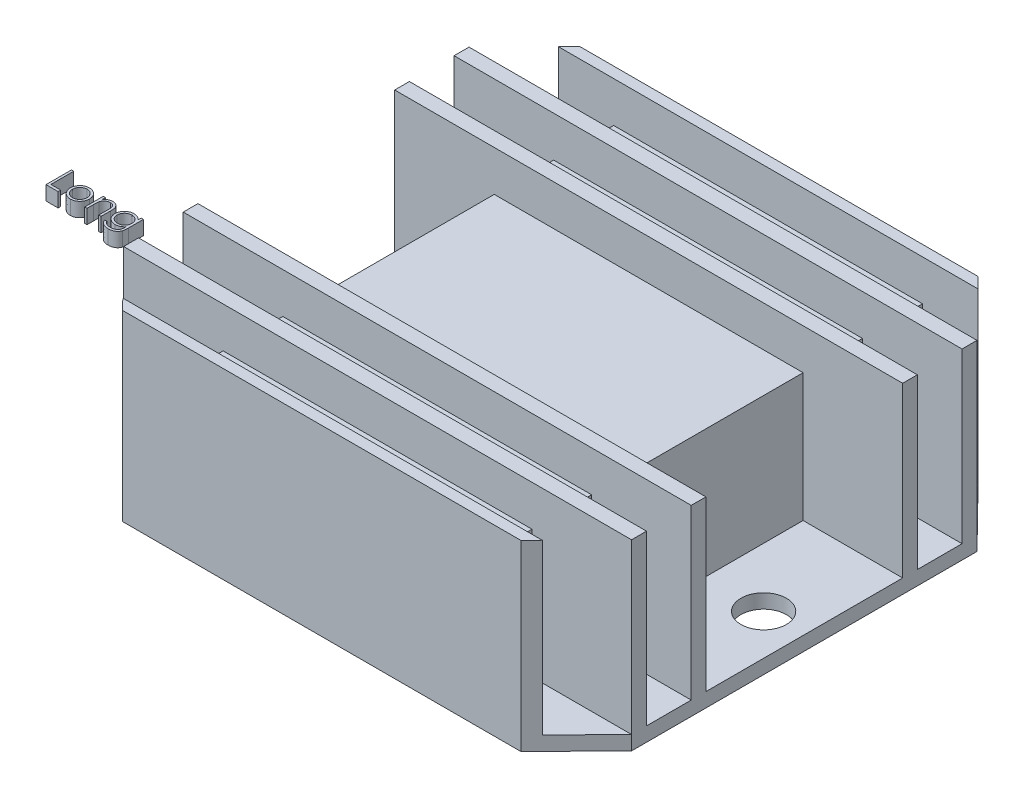
from build123d import *

# Parameters (mm, degrees)
BOSS_EXTRUDE1_DEPTH   = 1.778
BOSS_EXTRUDE1_2_DEPTH = 1.778
BOSS_EXTRUDE1_3_DEPTH = 1.778
BOSS_EXTRUDE1_4_DEPTH = 1.778
BOSS_EXTRUDE1_5_DEPTH = 1.778
SKETCH2_W             = 63.5
SKETCH2_H             = 1.867309241
SKETCH2_H_2           = 1.83559317
BOSS_EXTRUDE2_DEPTH   = 21.082
SKETCH3_W             = 38.608
SKETCH3_H             = 57.15
BOSS_EXTRUDE3_DEPTH   = 17.78
SKETCH4_R             = 2.842759409
CUT_EXTRUDE1_DEPTH    = 75.056497765


with BuildPart() as part:
    # Sketch1 → Boss-Extrude1 (new body)
    with BuildSketch(Plane(origin=(0, 0, 0), x_dir=(1, 0, 0), z_dir=(0, 1, 0))):
        Polygon((-24.892, -28.575), (24.892, -28.575), (31.75, -21.59), (31.75, 21.59), (24.892, 28.575), (-24.892, 28.575), (-31.75, 21.59), (-31.75, -21.59), align=None)
    extrude(amount=BOSS_EXTRUDE1_DEPTH)

    # Sketch2 → Boss-Extrude2 (add)
    with BuildSketch(Plane(origin=(0, 1.778, 0), x_dir=(1, 0, 0), z_dir=(0, 1, 0))):
        Polygon((-24.892, 28.575), (-26.219324492, 27.223095425), (26.219324492, 27.223095425), (24.892, 28.575), align=None)
        Polygon((26.219324492, -27.223095425), (24.892, -28.575), (-24.892, -28.575), (-26.219324492, -27.223095425), align=None)
        with Locations((0, 20.65634538)):
            Rectangle(SKETCH2_W, SKETCH2_H)
        with Locations((0, -20.65634538)):
            Rectangle(SKETCH2_W, SKETCH2_H)
        with Locations((0, 13.216894221)):
            Rectangle(SKETCH2_W, SKETCH2_H_2)
        with Locations((0, -13.216894221)):
            Rectangle(SKETCH2_W, SKETCH2_H_2)
    extrude(amount=BOSS_EXTRUDE2_DEPTH)

    # Sketch3 → Boss-Extrude3 (add)
    with BuildSketch(Plane(origin=(0, 0, 0), x_dir=(1, 0, 0), z_dir=(0, 1, 0))):
        Rectangle(SKETCH3_W, SKETCH3_H)
    extrude(amount=BOSS_EXTRUDE3_DEPTH)

    # Sketch4 → Cut-Extrude1 (cut, through all)
    with BuildSketch(Plane.XZ):
        with Locations(Location((-26.67, 0, 0), (0, 0, 270))):
            Circle(SKETCH4_R)
        with Locations(Location((26.67, 0, 0), (0, 0, 270))):
            Circle(SKETCH4_R)
    extrude(amount=-CUT_EXTRUDE1_DEPTH, mode=Mode.SUBTRACT)


with BuildPart() as body_2:
    # Sketch1 → Boss-Extrude1 2 (new body)
    with BuildSketch(Plane(origin=(0, 0, 0), x_dir=(1, 0, 0), z_dir=(0, 1, 0))):
        Polygon((-64.383651933, 4.516913908), (-64.098716035, 4.516913908), (-64.098716035, 1.667554934), (-62.877562189, 1.667554934), (-62.877562189, 1.341913908), (-64.383651933, 1.341913908), align=None)
    extrude(amount=BOSS_EXTRUDE1_2_DEPTH)


with BuildPart() as body_3:
    # Sketch1 → Boss-Extrude1 3 (new body)
    with BuildSketch(Plane(origin=(0, 0, 0), x_dir=(1, 0, 0), z_dir=(0, 1, 0))):
        with BuildLine():
            add(Edge.make_bspline(
                [(-61.309142718, 3.702811344), (-61.265607778, 3.701884343), (-61.180246399, 3.70006672), (-61.05523496, 3.680640286), (-60.935904729, 3.650933749), (-60.821798683, 3.609865975), (-60.714378187, 3.554818777), (-60.612078558, 3.489133205), (-60.515180272, 3.411316138), (-60.457102238, 3.351119891), (-60.427622285, 3.320564749)],
                knots=[0, 0, 0, 0, 1.054011418, 2.066658804, 3.057071809, 4.030435133, 4.997543892, 5.974964718, 6.972108034, 8, 8, 8, 8], degree=3))
            add(Edge.make_bspline(
                [(-60.427622285, 3.320564749), (-60.402238656, 3.291342062), (-60.351962639, 3.233462227), (-60.28749588, 3.139613207), (-60.231959179, 3.04242183), (-60.187452064, 2.940597469), (-60.152359221, 2.835029018), (-60.127443911, 2.725353622), (-60.112623977, 2.611813493), (-60.110625572, 2.534702868), (-60.109613471, 2.495649885)],
                knots=[0, 0, 0, 0, 1.025258237, 2.030674902, 3.01204498, 3.988269485, 4.97094183, 5.956517959, 6.965070386, 8, 8, 8, 8], degree=3))
            add(Edge.make_bspline(
                [(-60.109613471, 2.495649885), (-60.110503684, 2.456370547), (-60.112262787, 2.378752744), (-60.128903068, 2.264435176), (-60.154784838, 2.153587015), (-60.191825149, 2.046672343), (-60.239321434, 1.94336435), (-60.297279414, 1.844114259), (-60.36610581, 1.748726252), (-60.444123721, 1.658010299), (-60.530349352, 1.574402375), (-60.623890429, 1.501533159), (-60.722908731, 1.439102205), (-60.828720916, 1.388813457), (-60.940360708, 1.349162514), (-61.058068905, 1.321313214), (-61.181662647, 1.304475115), (-61.266051627, 1.302312873), (-61.309142718, 1.30120878)],
                knots=[0, 0, 0, 0, 0.998656419, 1.973391657, 2.932242238, 3.890759089, 4.846373663, 5.82037756, 6.809684879, 7.83454468, 8.860553229, 9.859544525, 10.845671541, 11.83227036, 12.833544569, 13.85385346, 14.904124723, 16, 16, 16, 16], degree=3))
            add(Edge.make_bspline(
                [(-61.309142718, 1.30120878), (-61.352444928, 1.302316579), (-61.437254493, 1.30448626), (-61.561284491, 1.321247795), (-61.679203646, 1.349149679), (-61.790989589, 1.388943762), (-61.8972567, 1.439103813), (-61.996848736, 1.501344417), (-62.090465802, 1.574423986), (-62.176709674, 1.658004443), (-62.254722695, 1.748727761), (-62.323550352, 1.844113867), (-62.381508005, 1.943364452), (-62.429004376, 2.046672316), (-62.466044663, 2.153587023), (-62.49192644, 2.264435174), (-62.508566719, 2.378752744), (-62.510325822, 2.456370548), (-62.511216035, 2.495649885)],
                knots=[0, 0, 0, 0, 1.099876186, 2.154163076, 3.173186993, 4.173200201, 5.163417411, 6.152872554, 7.150605724, 8.17532212, 9.198891216, 10.186952605, 11.159729845, 12.11414092, 13.071450619, 14.029093627, 15.002601286, 16, 16, 16, 16], degree=3))
            add(Edge.make_bspline(
                [(-62.511216035, 2.495649885), (-62.510197032, 2.534490609), (-62.508179582, 2.611388567), (-62.493374548, 2.724715258), (-62.468556429, 2.834205032), (-62.43342152, 2.939366), (-62.388504168, 3.040744145), (-62.333747857, 3.138175671), (-62.268623497, 3.231600318), (-62.218547441, 3.289405348), (-62.193207221, 3.318656696)],
                knots=[0, 0, 0, 0, 1.031353054, 2.041901799, 3.029428768, 4.008703097, 4.981709435, 5.96992636, 6.972712378, 8, 8, 8, 8], degree=3))
            add(Edge.make_bspline(
                [(-62.193207221, 3.318656696), (-62.163771714, 3.34947682), (-62.105881609, 3.410090016), (-62.008500977, 3.487680234), (-61.906453011, 3.554732672), (-61.797845399, 3.608686096), (-61.683833092, 3.651175323), (-61.563891351, 3.680716898), (-61.438455705, 3.699996727), (-61.35267662, 3.701863788), (-61.309142718, 3.702811344)],
                knots=[0, 0, 0, 0, 1.027980169, 2.021703884, 2.998553061, 3.971491411, 4.943284454, 5.930300938, 6.949603206, 8, 8, 8, 8], degree=3))
        make_face()
        with BuildLine():
            add(Edge.make_bspline(
                [(-61.310414753, 3.417875446), (-61.341201015, 3.417000424), (-61.401978796, 3.415272968), (-61.491440848, 3.402133997), (-61.57756513, 3.381317332), (-61.660515039, 3.351740796), (-61.740010845, 3.31355108), (-61.81612866, 3.266644211), (-61.889092374, 3.211641457), (-61.957474674, 3.148628891), (-62.020232914, 3.079795803), (-62.075095079, 3.006454792), (-62.121744997, 2.929795463), (-62.160607141, 2.8497381), (-62.189551519, 2.765471411), (-62.21057276, 2.677949695), (-62.223699336, 2.586994639), (-62.225410551, 2.525162858), (-62.226280138, 2.493741833)],
                knots=[0, 0, 0, 0, 1.021534396, 2.016698045, 2.994645724, 3.958388632, 4.93408049, 5.916473867, 6.921342795, 7.962252576, 8.998418191, 10.008913653, 10.997312074, 11.973003931, 12.956656626, 13.948281152, 14.957379055, 16, 16, 16, 16], degree=3))
            add(Edge.make_bspline(
                [(-62.226280138, 2.493741833), (-62.224822519, 2.453145351), (-62.221929419, 2.372568926), (-62.198402454, 2.25390455), (-62.159044901, 2.13998387), (-62.105897868, 2.03147472), (-62.039307941, 1.931079153), (-61.960851817, 1.841570021), (-61.871371517, 1.764294321), (-61.771933692, 1.700176697), (-61.664569418, 1.649231775), (-61.550944041, 1.613128419), (-61.432434268, 1.589659098), (-61.351443891, 1.587326403), (-61.310414753, 1.586144677)],
                knots=[0, 0, 0, 0, 1.016792936, 2.018143844, 3.017858371, 4.030088057, 5.03801393, 6.028138512, 7.003788237, 7.991172063, 8.984598303, 9.972568034, 10.972917682, 12, 12, 12, 12], degree=3))
            add(Edge.make_bspline(
                [(-61.310414753, 1.586144677), (-61.269387976, 1.587333288), (-61.188402256, 1.589679574), (-61.070057146, 1.613010218), (-60.956742329, 1.649389967), (-60.84948957, 1.700119401), (-60.750097008, 1.764537805), (-60.659973163, 1.841133662), (-60.582186922, 1.931316227), (-60.515662867, 2.031607699), (-60.461645464, 2.139815647), (-60.422472131, 2.253925576), (-60.398888607, 2.372563571), (-60.396003141, 2.453143557), (-60.394549369, 2.493741833)],
                knots=[0, 0, 0, 0, 1.02726834, 2.027799167, 3.010890988, 4.004497153, 4.992059811, 5.971914811, 6.958719428, 7.966827853, 8.981595046, 9.981490638, 10.983022906, 12, 12, 12, 12], degree=3))
            add(Edge.make_bspline(
                [(-60.394549369, 2.493741833), (-60.395418656, 2.525163046), (-60.397129282, 2.586995196), (-60.410260143, 2.677947565), (-60.431265525, 2.765479227), (-60.460268349, 2.849709259), (-60.498961633, 2.930002745), (-60.546511153, 3.006229712), (-60.601149297, 3.080049864), (-60.664664828, 3.148406381), (-60.73297575, 3.211666021), (-60.805969034, 3.266665539), (-60.881973979, 3.313344929), (-60.961238836, 3.352067447), (-61.04419938, 3.381048249), (-61.13020299, 3.402254193), (-61.219283339, 3.415217443), (-61.279843328, 3.416983779), (-61.310414753, 3.417875446)],
                knots=[0, 0, 0, 0, 1.042956736, 2.052379634, 3.044323526, 4.02829302, 5.004299113, 5.996692471, 7.007513377, 8.048758398, 9.090003419, 10.095195979, 11.07790575, 12.047570684, 13.018257071, 13.989683339, 14.985167495, 16, 16, 16, 16], degree=3))
        make_face(mode=Mode.SUBTRACT)
    extrude(amount=BOSS_EXTRUDE1_3_DEPTH)


with BuildPart() as body_4:
    # Sketch1 → Boss-Extrude1 4 (new body)
    with BuildSketch(Plane(origin=(0, 0, 0), x_dir=(1, 0, 0), z_dir=(0, 1, 0))):
        with BuildLine():
            Line((-59.539741676, 3.662106216), (-59.254805779, 3.662106216))
            Line((-59.254805779, 3.662106216), (-59.254805779, 3.243606616))
            add(Edge.make_bspline(
                [(-59.254805779, 3.243606616), (-59.224382353, 3.281563943), (-59.165344633, 3.355221461), (-59.067024559, 3.452032268), (-58.963116878, 3.531811151), (-58.854257918, 3.595405307), (-58.740299901, 3.643344746), (-58.621937471, 3.677966698), (-58.498461987, 3.698726506), (-58.41449282, 3.701439073), (-58.372013311, 3.702811344)],
                knots=[0, 0, 0, 0, 1.12780773, 2.188550248, 3.19190651, 4.159438251, 5.104880172, 6.052711206, 7.014878035, 8, 8, 8, 8], degree=3))
            add(Edge.make_bspline(
                [(-58.372013311, 3.702811344), (-58.329077664, 3.701228202), (-58.245042247, 3.698129612), (-58.122688577, 3.673621614), (-58.008412713, 3.631761275), (-57.902622116, 3.574418897), (-57.807256715, 3.503111596), (-57.723504886, 3.420037466), (-57.654232511, 3.32448259), (-57.607789189, 3.235833727), (-57.577195209, 3.157194606), (-57.557934445, 3.089842197), (-57.541577769, 3.014805017), (-57.527397541, 2.932309819), (-57.517802589, 2.841778603), (-57.510234939, 2.743582483), (-57.504811409, 2.637753264), (-57.504596229, 2.564558967), (-57.504485266, 2.526814749)],
                knots=[0, 0, 0, 0, 1.235846778, 2.418850247, 3.575807741, 4.728682307, 5.871620074, 6.994088408, 8.11269785, 9.256955736, 9.865816715, 10.540099792, 11.271859618, 12.076849838, 12.949306005, 13.892391288, 14.913166135, 16, 16, 16, 16], degree=3))
            Line((-57.504485266, 2.526814749), (-57.504485266, 1.341913908))
            Line((-57.504485266, 1.341913908), (-57.789421163, 1.341913908))
            Line((-57.789421163, 1.341913908), (-57.789421163, 2.433320158))
            add(Edge.make_bspline(
                [(-57.789421163, 2.433320158), (-57.789596431, 2.46490909), (-57.789931687, 2.525333341), (-57.790989095, 2.611846669), (-57.793537991, 2.690302351), (-57.797119675, 2.76051282), (-57.802362081, 2.822410658), (-57.807825468, 2.87612193), (-57.814506554, 2.921578444), (-57.820460054, 2.948942483), (-57.823130098, 2.961214789)],
                knots=[0, 0, 0, 0, 1.430800155, 2.736877192, 3.918605307, 4.986035426, 5.920637409, 6.731861385, 7.431261377, 8, 8, 8, 8], degree=3))
            add(Edge.make_bspline(
                [(-57.823130098, 2.961214789), (-57.832768973, 2.997238507), (-57.851320825, 3.066573018), (-57.897162367, 3.160620467), (-57.955050945, 3.240628823), (-58.025715423, 3.30610342), (-58.108473227, 3.357058394), (-58.203094707, 3.392413338), (-58.308666759, 3.414526097), (-58.382920378, 3.416727852), (-58.421622686, 3.417875446)],
                knots=[0, 0, 0, 0, 1.084156227, 2.086665306, 3.027808233, 3.945421172, 4.874247719, 5.839848303, 6.874090471, 8, 8, 8, 8], degree=3))
            add(Edge.make_bspline(
                [(-58.421622686, 3.417875446), (-58.444544085, 3.417443642), (-58.48990494, 3.416589113), (-58.557169558, 3.408015435), (-58.622415058, 3.393992408), (-58.686296247, 3.375061572), (-58.74753546, 3.349060799), (-58.80810021, 3.319552014), (-58.865709918, 3.282768993), (-58.921592999, 3.241774643), (-58.973583903, 3.196345648), (-59.021960325, 3.148408128), (-59.0650841, 3.097358116), (-59.104153541, 3.044018164), (-59.137879537, 2.987655711), (-59.167319124, 2.928814518), (-59.192297933, 2.867417141), (-59.20471009, 2.824804049), (-59.210920563, 2.803482417)],
                knots=[0, 0, 0, 0, 1.023777757, 2.026029729, 3.023749952, 4.003683103, 4.997618607, 5.993177895, 7.010360494, 8.046726602, 9.087585522, 10.09234134, 11.086953743, 12.070360549, 13.043493632, 14.017870808, 15.008233677, 16, 16, 16, 16], degree=3))
            add(Edge.make_bspline(
                [(-59.210920563, 2.803482417), (-59.214494387, 2.787829483), (-59.222274415, 2.753753864), (-59.230677442, 2.69783357), (-59.238304314, 2.633145235), (-59.244687841, 2.559764348), (-59.248593469, 2.477433989), (-59.252851957, 2.386505765), (-59.25440232, 2.286617101), (-59.254667526, 2.217073994), (-59.254805779, 2.180821159)],
                knots=[0, 0, 0, 0, 0.615963638, 1.340920617, 2.168419149, 3.115676021, 4.16674242, 5.331190069, 6.6087489, 8, 8, 8, 8], degree=3))
            Line((-59.254805779, 2.180821159), (-59.254805779, 1.341913908))
            Line((-59.254805779, 1.341913908), (-59.539741676, 1.341913908))
            Line((-59.539741676, 1.341913908), (-59.539741676, 3.662106216))
        make_face()
    extrude(amount=BOSS_EXTRUDE1_4_DEPTH)


with BuildPart() as body_5:
    # Sketch1 → Boss-Extrude1 5 (new body)
    with BuildSketch(Plane(origin=(0, 0, 0), x_dir=(1, 0, 0), z_dir=(0, 1, 0))):
        with BuildLine():
            Line((-54.817946804, 3.662106216), (-54.533010907, 3.662106216))
            Line((-54.533010907, 3.662106216), (-54.533010907, 1.820835182))
            add(Edge.make_bspline(
                [(-54.533010907, 1.820835182), (-54.533262224, 1.781612507), (-54.533747327, 1.705903296), (-54.537240708, 1.596430856), (-54.544607322, 1.495315193), (-54.552960912, 1.402095144), (-54.564977576, 1.317202802), (-54.579651852, 1.240384852), (-54.596194218, 1.171567577), (-54.610726844, 1.129181471), (-54.617601252, 1.109131456)],
                knots=[0, 0, 0, 0, 1.307562039, 2.523909702, 3.650326591, 4.686913197, 5.643429486, 6.506965704, 7.293745905, 8, 8, 8, 8], degree=3))
            add(Edge.make_bspline(
                [(-54.617601252, 1.109131456), (-54.62775149, 1.083069313), (-54.64774848, 1.031724268), (-54.685200448, 0.958940277), (-54.727141203, 0.890408909), (-54.77504447, 0.826512078), (-54.828693628, 0.76757055), (-54.886824695, 0.71230378), (-54.950569798, 0.661880999), (-55.019892487, 0.617172194), (-55.09319474, 0.576906794), (-55.170434418, 0.542030266), (-55.251175973, 0.511652915), (-55.336177881, 0.488899236), (-55.424107451, 0.469182739), (-55.515998692, 0.456351488), (-55.611314729, 0.447618371), (-55.676125896, 0.446810803), (-55.709007502, 0.446401087)],
                knots=[0, 0, 0, 0, 0.981931301, 1.934503488, 2.87077864, 3.801706999, 4.735015492, 5.667491629, 6.616593066, 7.585388521, 8.561939025, 9.551802639, 10.560317337, 11.588439944, 12.640189604, 13.723962949, 14.845264515, 16, 16, 16, 16], degree=3))
            add(Edge.make_bspline(
                [(-55.709007502, 0.446401087), (-55.756981511, 0.447178042), (-55.85068764, 0.448695644), (-55.987307883, 0.466376689), (-56.117060808, 0.491372441), (-56.238231922, 0.529205222), (-56.35005551, 0.575503063), (-56.451767883, 0.628657056), (-56.542455959, 0.689607357), (-56.624211005, 0.759004331), (-56.697999448, 0.841521385), (-56.767420632, 0.938766051), (-56.834241629, 1.052219586), (-56.873401751, 1.13548869), (-56.893908343, 1.179093395)],
                knots=[0, 0, 0, 0, 1.157897085, 2.2616841, 3.32207898, 4.345638746, 5.321241055, 6.241986252, 7.112515963, 7.955008012, 8.825025602, 9.77857164, 10.836726669, 12, 12, 12, 12], degree=3))
            Line((-56.893908343, 1.179093395), (-56.608972446, 1.179093395))
            add(Edge.make_bspline(
                [(-56.608972446, 1.179093395), (-56.586056013, 1.142711636), (-56.541257209, 1.071589778), (-56.457483944, 0.979502844), (-56.365675348, 0.900805149), (-56.262733064, 0.837386089), (-56.148228761, 0.789570779), (-56.022093553, 0.755484617), (-55.883301039, 0.735077289), (-55.786673802, 0.732617758), (-55.73635626, 0.731336985)],
                knots=[0, 0, 0, 0, 0.997731894, 1.950442991, 2.880492273, 3.800895997, 4.748200782, 5.754801363, 6.83083817, 8, 8, 8, 8], degree=3))
            add(Edge.make_bspline(
                [(-55.73635626, 0.731336985), (-55.686674866, 0.732634334), (-55.590894113, 0.735135494), (-55.453161552, 0.755493724), (-55.327436144, 0.789578196), (-55.214442248, 0.837301518), (-55.115513086, 0.895767244), (-55.03023078, 0.961081597), (-54.961156681, 1.034724364), (-54.914699204, 1.102562146), (-54.885820658, 1.162999749), (-54.867430843, 1.215026747), (-54.8524866, 1.273857571), (-54.839986318, 1.339294989), (-54.829671275, 1.411432493), (-54.823137232, 1.490435023), (-54.818414817, 1.576123032), (-54.818106416, 1.635534664), (-54.817946804, 1.666282898)],
                knots=[0, 0, 0, 0, 1.570740765, 3.028230971, 4.391408896, 5.680370741, 6.894727393, 8.017376726, 9.065722033, 10.075533815, 10.603371122, 11.180248986, 11.817768598, 12.521299649, 13.286540596, 14.121245857, 15.027658897, 16, 16, 16, 16], degree=3))
            Line((-54.817946804, 1.666282898), (-54.817946804, 1.78649023))
            add(Edge.make_bspline(
                [(-54.817946804, 1.78649023), (-54.846867532, 1.752071595), (-54.904200282, 1.683839739), (-55.0032125, 1.594430254), (-55.111359273, 1.517426407), (-55.228456487, 1.45427236), (-55.351635821, 1.403761354), (-55.47956313, 1.368434525), (-55.611091637, 1.345610901), (-55.700220373, 1.343154979), (-55.745260506, 1.341913908)],
                knots=[0, 0, 0, 0, 1.012485704, 2.007162095, 2.997754123, 3.998611389, 4.999708251, 5.992315798, 6.98544096, 8, 8, 8, 8], degree=3))
            add(Edge.make_bspline(
                [(-55.745260506, 1.341913908), (-55.771781979, 1.34238111), (-55.824511071, 1.343309987), (-55.902847163, 1.351436878), (-55.980027275, 1.363228594), (-56.055871406, 1.380538185), (-56.130488998, 1.40275568), (-56.203756742, 1.430529436), (-56.27626787, 1.461930293), (-56.346704336, 1.49891705), (-56.414364612, 1.540067143), (-56.478738358, 1.584643137), (-56.53948839, 1.632411727), (-56.596036491, 1.683843951), (-56.648308486, 1.73886537), (-56.697007423, 1.79688945), (-56.741328017, 1.858726422), (-56.782179734, 1.923248734), (-56.817610512, 1.990886143), (-56.848711335, 2.060171987), (-56.875752724, 2.130958117), (-56.897311338, 2.203481524), (-56.913776991, 2.277696486), (-56.926032697, 2.353481422), (-56.932984071, 2.431069702), (-56.934068037, 2.483340497), (-56.934613471, 2.509642273)],
                knots=[0, 0, 0, 0, 1.028754217, 2.045334182, 3.052854819, 4.056607503, 5.061168794, 6.071104265, 7.095078842, 8.125279047, 9.155117945, 10.165957491, 11.161587969, 12.151493252, 13.128948131, 14.104219989, 15.088194871, 16.07871515, 17.064853787, 18.047899887, 19.02414258, 20.002704429, 20.980574569, 21.971845993, 22.979467364, 24, 24, 24, 24], degree=3))
            add(Edge.make_bspline(
                [(-56.934613471, 2.509642273), (-56.934142513, 2.535952225), (-56.933202421, 2.588470225), (-56.925082604, 2.666375096), (-56.913500032, 2.743236798), (-56.895168699, 2.818263084), (-56.873104697, 2.892308394), (-56.845778313, 2.964825808), (-56.812922724, 3.035837413), (-56.775721023, 3.105395795), (-56.733916167, 3.17256756), (-56.688075988, 3.236363875), (-56.638145145, 3.296315288), (-56.584812479, 3.353026613), (-56.527426788, 3.405950682), (-56.466017759, 3.454959043), (-56.401190717, 3.500873196), (-56.332744748, 3.542702766), (-56.261735974, 3.579698089), (-56.189968439, 3.613455231), (-56.116491469, 3.640246896), (-56.042674951, 3.663853565), (-55.967218885, 3.68057692), (-55.891048464, 3.693478526), (-55.813902915, 3.701338665), (-55.762238503, 3.702319817), (-55.73635626, 3.702811344)],
                knots=[0, 0, 0, 0, 1.008818848, 2.013730394, 3.001654427, 3.987803273, 4.973046549, 5.963777569, 6.957074694, 7.972068341, 8.987420212, 9.989399531, 10.982630087, 11.977756091, 12.973280677, 13.973972381, 14.989194003, 16.018387222, 17.047741039, 18.059210846, 19.057554164, 20.045176975, 21.029480261, 22.018708529, 23.007435371, 24, 24, 24, 24], degree=3))
            add(Edge.make_bspline(
                [(-55.73635626, 3.702811344), (-55.693674336, 3.701580647), (-55.609390653, 3.6991504), (-55.485356101, 3.680081218), (-55.36566564, 3.64967922), (-55.249643869, 3.606122184), (-55.136345671, 3.546658935), (-55.026144455, 3.468333546), (-54.918721383, 3.370443452), (-54.852429351, 3.295374783), (-54.817946804, 3.256326969)],
                knots=[0, 0, 0, 0, 0.96728863, 1.910097829, 2.838038873, 3.762875196, 4.71315279, 5.730631239, 6.819562287, 8, 8, 8, 8], degree=3))
            Line((-54.817946804, 3.256326969), (-54.817946804, 3.662106216))
        make_face()
        with BuildLine():
            add(Edge.make_bspline(
                [(-55.713459625, 3.417875446), (-55.755125335, 3.416459337), (-55.837614606, 3.413655741), (-55.958526174, 3.389721036), (-56.075254535, 3.352214399), (-56.18556803, 3.298563597), (-56.288898051, 3.233163824), (-56.380587353, 3.153933706), (-56.460783241, 3.063449656), (-56.528622049, 2.962529789), (-56.582625503, 2.85365244), (-56.620855605, 2.738889131), (-56.645575269, 2.620094244), (-56.648303639, 2.539020526), (-56.649677574, 2.498193956)],
                knots=[0, 0, 0, 0, 1.026226791, 2.031711442, 3.026614839, 4.04107745, 5.047145931, 6.032893242, 7.017642609, 8.019221815, 9.021877557, 10.003543541, 10.994637589, 12, 12, 12, 12], degree=3))
            add(Edge.make_bspline(
                [(-56.649677574, 2.498193956), (-56.649019209, 2.46741163), (-56.647724397, 2.406871797), (-56.635275151, 2.318028135), (-56.615153847, 2.233409565), (-56.58663581, 2.153010968), (-56.551300151, 2.07637119), (-56.506857072, 2.00401817), (-56.454559405, 1.935887472), (-56.394816484, 1.872483011), (-56.328979337, 1.814733418), (-56.257569778, 1.763989624), (-56.180684659, 1.722487184), (-56.100214909, 1.686617996), (-56.014208009, 1.660420556), (-55.923902767, 1.640428235), (-55.828660299, 1.628990291), (-55.763734507, 1.62757261), (-55.730632101, 1.626849805)],
                knots=[0, 0, 0, 0, 1.039728707, 2.044842319, 3.024901384, 3.974314358, 4.923051295, 5.871625912, 6.837440708, 7.820715446, 8.810779094, 9.792721783, 10.773906224, 11.758876063, 12.764959493, 13.806266761, 14.881525401, 16, 16, 16, 16], degree=3))
            add(Edge.make_bspline(
                [(-55.730632101, 1.626849805), (-55.697100692, 1.627546136), (-55.631530376, 1.628907804), (-55.535762455, 1.640613121), (-55.44501847, 1.659501628), (-55.359381624, 1.686319515), (-55.278528578, 1.720538532), (-55.203367607, 1.763842463), (-55.132287114, 1.81315877), (-55.067556657, 1.870682525), (-55.009024021, 1.934078199), (-54.958014683, 2.003061783), (-54.914549433, 2.076595254), (-54.878556118, 2.154670323), (-54.851077668, 2.237893743), (-54.832645519, 2.326057466), (-54.819757971, 2.418739108), (-54.818559704, 2.482246924), (-54.817946804, 2.514730414)],
                knots=[0, 0, 0, 0, 1.121943988, 2.193949579, 3.223793937, 4.220241907, 5.192961521, 6.155822191, 7.11847367, 8.083710714, 9.04790392, 10.001595906, 10.949595423, 11.902125208, 12.873731292, 13.87582262, 14.913508608, 16, 16, 16, 16], degree=3))
            add(Edge.make_bspline(
                [(-54.817946804, 2.514730414), (-54.819161984, 2.557019468), (-54.821536018, 2.639637417), (-54.843939868, 2.760021414), (-54.880062488, 2.873204425), (-54.93072347, 2.978828489), (-54.994207149, 3.075774437), (-55.070670991, 3.162246782), (-55.158796319, 3.238356845), (-55.258329938, 3.301764492), (-55.365415835, 3.352986707), (-55.477467205, 3.391414886), (-55.594317696, 3.413181158), (-55.673517081, 3.416301678), (-55.713459625, 3.417875446)],
                knots=[0, 0, 0, 0, 1.070913519, 2.092188694, 3.091357305, 4.074328408, 5.051968682, 6.018948707, 6.99050112, 7.9935919, 9.000589572, 9.992915277, 10.987769056, 12, 12, 12, 12], degree=3))
        make_face(mode=Mode.SUBTRACT)
    extrude(amount=BOSS_EXTRUDE1_5_DEPTH)


solid = Compound([part.part, body_2.part, body_3.part, body_4.part, body_5.part])
